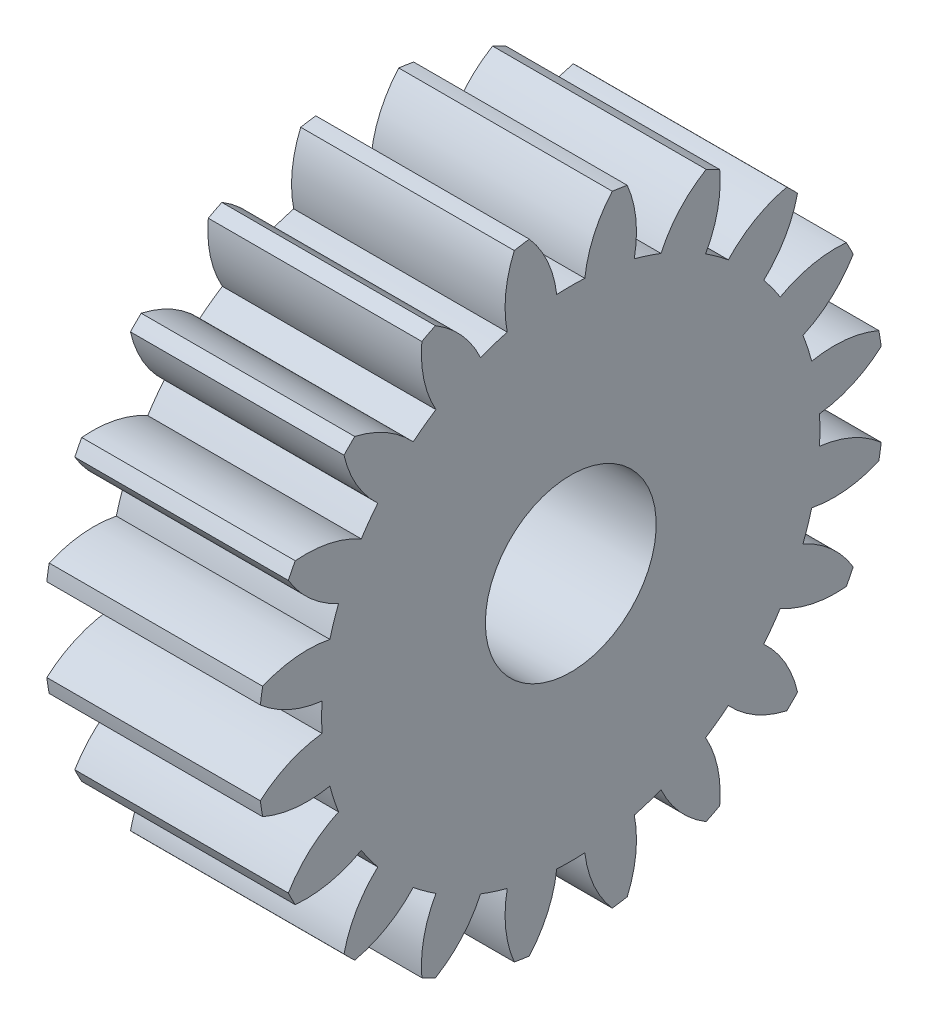
from build123d import *

# Parameters (mm, degrees)
BASPROSKE_W     = 15
BASPROSKE_H     = 22
TOOTHCUT_DEPTH  = 35.539832078
TEETHCUTS_COUNT = 20
TEETHCUTS_ANGLE = 342
BORSKE_R        = 6
BORE_DEPTH      = 50.0000508


with BuildPart() as part:
    # BasProSke → Base-Revolve (revolve)
    with BuildSketch(Plane(origin=(0, 0, 0), x_dir=(1, 0, 0), z_dir=(0, 1, 0)), mode=Mode.PRIVATE) as base_revolve_sk:
        with Locations((7.5, 11)):
            Rectangle(BASPROSKE_W, BASPROSKE_H)
    revolve(base_revolve_sk.sketch.rotate(Axis((-10, 0, 0), (1, 0, 0)), 180), axis=Axis((-10, 0, 0), (1, 0, 0)))

    # TooCutSke → ToothCut (cut, through all)
    with BuildSketch(Plane(origin=(0, 0, 0), x_dir=(0, 0, -1), z_dir=(1, 0, 0))):
        with BuildLine():
            ThreePointArc((0.986171591, 17.471189616), (0, 17.499), (-0.986171591, 17.471189616))
            ThreePointArc((-0.986171591, 17.471189616), (-1.626916196, 19.798789858), (-2.932850173, 21.829260982))
            ThreePointArc((-2.932850173, 21.829260982), (0, 22.0254), (2.932850173, 21.829260982))
            ThreePointArc((2.932850173, 21.829260982), (1.626916196, 19.798789858), (0.986171591, 17.471189616))
        make_face()
    toothcut = extrude(amount=TOOTHCUT_DEPTH, mode=Mode.SUBTRACT)

    # TeethCuts: ToothCut ×20 about axis
    teethcuts_axis = Axis((-10, 0, 0), (1, 0, 0))
    for i in range(1, TEETHCUTS_COUNT):
        add(toothcut.rotate(teethcuts_axis, i * TEETHCUTS_ANGLE / (TEETHCUTS_COUNT - 1)), mode=Mode.SUBTRACT)

    # BorSke → Bore (cut, symmetric)
    with BuildSketch(Plane(origin=(0, 0, 0), x_dir=(0, 0, -1), z_dir=(1, 0, 0))):
        with Locations(Location((0, 0, 0), (0, 0, 180))):
            Circle(BORSKE_R)
    extrude(amount=BORE_DEPTH, both=True, mode=Mode.SUBTRACT)


solid = part.part
